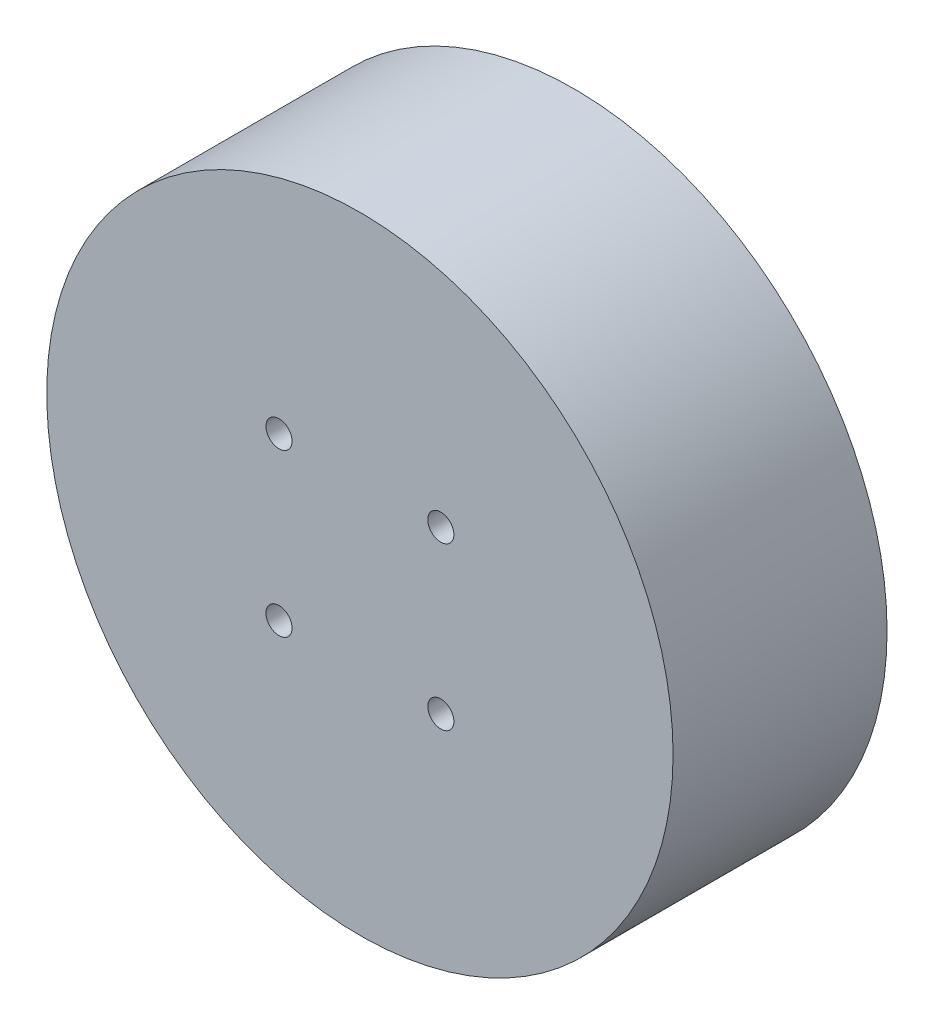
from build123d import *

# Parameters (mm, degrees)
SKETCH1_R           = 60
BOSS_EXTRUDE1_DEPTH = 20.5
SKETCH2_R           = 2.5
CUT_EXTRUDE1_DEPTH  = 10


with BuildPart() as part:
    # Sketch1 → Boss-Extrude1 (new, symmetric)
    with BuildSketch(Plane.XY):
        Circle(SKETCH1_R)
    extrude(amount=BOSS_EXTRUDE1_DEPTH, both=True)

    # Sketch2 → Cut-Extrude1 (cut)
    with BuildSketch(Plane.XY.offset(20.5)):
        with Locations((-15.5, 15.5)):
            Circle(SKETCH2_R)
        with Locations((15.5, 15.5)):
            Circle(SKETCH2_R)
        with Locations((15.5, -15.5)):
            Circle(SKETCH2_R)
        with Locations((-15.5, -15.5)):
            Circle(SKETCH2_R)
    extrude(amount=-CUT_EXTRUDE1_DEPTH, mode=Mode.SUBTRACT)


solid = part.part
